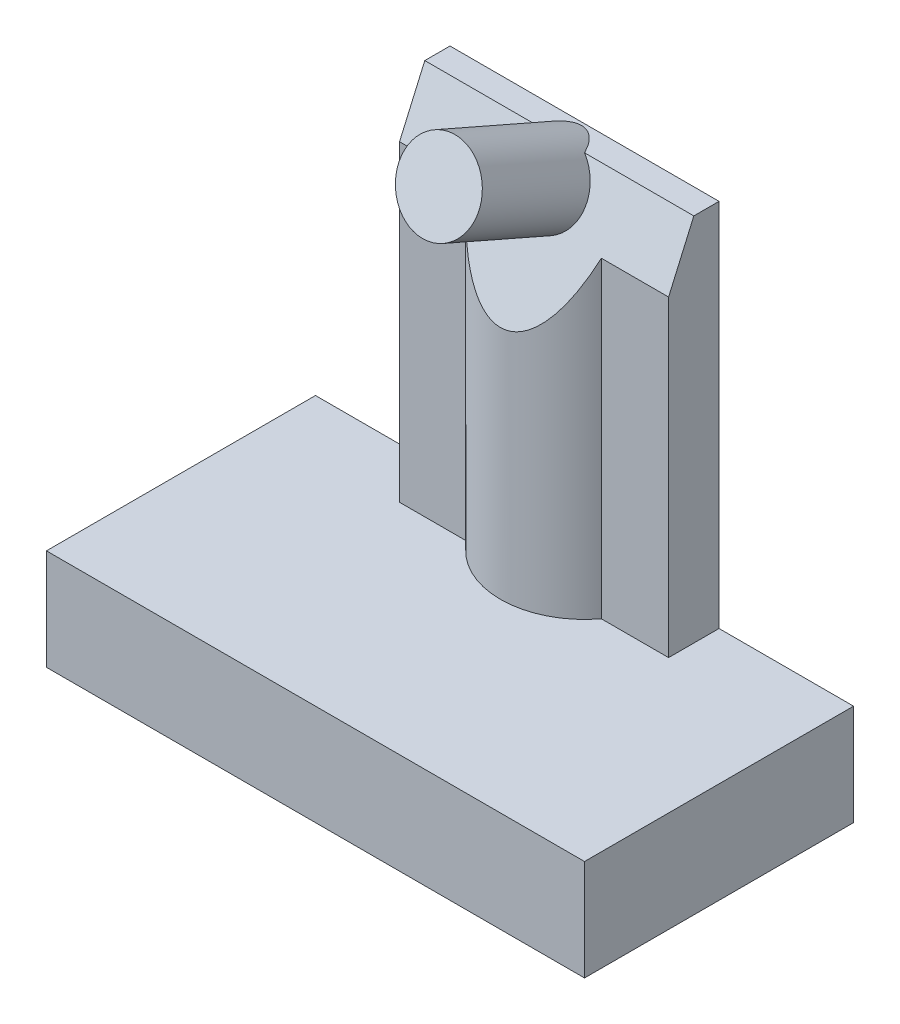
from build123d import *

# Parameters (mm, degrees)
SKETCH1_W                       = 16
SKETCH1_H                       = 8
BOSS_EXTRUDE1_DEPTH             = 3
SHELL1_T                        = -1
SKETCH2_R                       = 1.5
SKETCH2_R_2                     = 0.8
BOSS_EXTRUDE2_DEPTH             = 2
BOSS_EXTRUDE3_DEPTH             = 11
CUT_EXTRUDE1_DEPTH              = 19.867962264
BOSS_EXTRUDE4_REACH             = 18.513
SKETCH5_R                       = 1.2
BOSS_EXTRUDE4_DIRECTION_2_DEPTH = 3.5


with BuildPart() as part:
    # Sketch1 → Boss-Extrude1 (new body)
    with BuildSketch(Plane(origin=(0, 0, 0), x_dir=(1, 0, 0), z_dir=(0, 1, 0))):
        Rectangle(SKETCH1_W, SKETCH1_H)
    extrude(amount=BOSS_EXTRUDE1_DEPTH)

    # Shell1
    shell1_openings = [part.faces().sort_by_distance(p)[0] for p in [
        (0, 0, 0),
    ]]
    offset(amount=SHELL1_T, openings=shell1_openings, kind=Kind.INTERSECTION)

    # Sketch2 → Boss-Extrude2 (add)
    with BuildSketch(Plane.XZ.offset(-2)):
        Circle(SKETCH2_R)
        Circle(SKETCH2_R_2, mode=Mode.SUBTRACT)
    extrude(amount=BOSS_EXTRUDE2_DEPTH)

    # Sketch3 → Boss-Extrude3 (add)
    with BuildSketch(Plane(origin=(0, 3, 0), x_dir=(1, 0, 0), z_dir=(0, 1, 0))):
        with BuildLine():
            ThreePointArc((-2, 2.5), (0, 1.5), (2, 2.5))
            Line((2, 2.5), (4, 2.5))
            Line((4, 2.5), (4, 4))
            Line((4, 4), (-4, 4))
            Line((-4, 4), (-4, 2.5))
            Line((-4, 2.5), (-2, 2.5))
        make_face()
    extrude(amount=BOSS_EXTRUDE3_DEPTH)

    # Sketch4 → Cut-Extrude1 (cut, through all)
    with BuildSketch(Plane(origin=(4, 0, 0), x_dir=(0, 0, -1), z_dir=(1, 0, 0))):
        Polygon((3.25, 14), (1.5, 14), (1.5, 10), align=None)
    extrude(amount=-CUT_EXTRUDE1_DEPTH, mode=Mode.SUBTRACT)

    # Sketch5 → Boss-Extrude4 (add, up to next)
    with BuildSketch(Plane(origin=(0, 1.055737705, 2.413114754), x_dir=(1, 0, 0), z_dir=(0, 0.4008188340197083, 0.916157334902189)), mode=Mode.PRIVATE) as boss_extrude4_sk1:
        with Locations((0, 13.193279121)):
            Circle(SKETCH5_R)
    boss_extrude4_tool1 = extrude(boss_extrude4_sk1.sketch, amount=-BOSS_EXTRUDE4_REACH, mode=Mode.PRIVATE) - part.part
    add(boss_extrude4_tool1.solids().sort_by_distance((0, 13.142857, -2.875))[0])

    # Sketch5 → Boss-Extrude4 direction 2 (add)
    with BuildSketch(Plane(origin=(0, 1.055737705, 2.413114754), x_dir=(1, 0, 0), z_dir=(0, 0.4008188340197083, 0.916157334902189))):
        with Locations((0, 13.193279121)):
            Circle(SKETCH5_R)
    extrude(amount=BOSS_EXTRUDE4_DIRECTION_2_DEPTH)


solid = part.part
